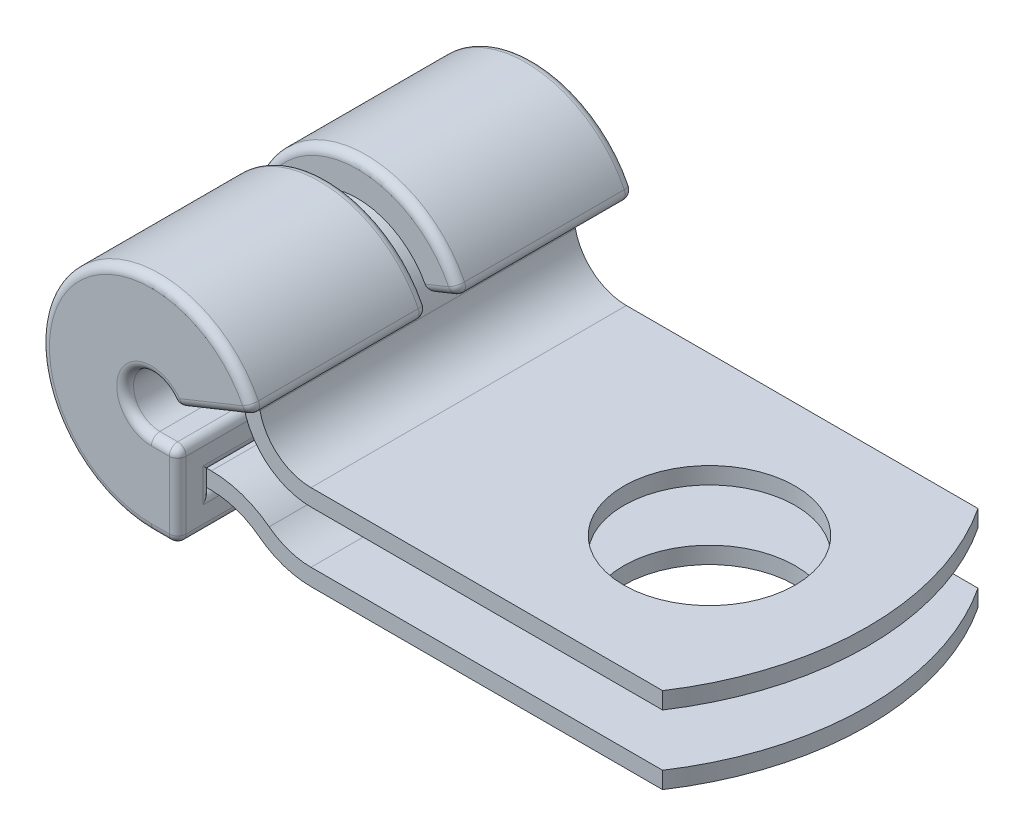
from build123d import *
from build123d.topology import SkipClean

# Parameters (mm, degrees)
BOSS_EXTRUDE1_DEPTH      = 4.7625
BOSS_EXTRUDE1_DEPTH_BACK = 4.7625
SKETCH2_R                = 2.5908
CUT_EXTRUDE1_DEPTH       = 17.882095
CUT_EXTRUDE3_DEPTH       = 17.882095
CUT_EXTRUDE3_DEPTH_BACK  = 17.882095
BOSS_EXTRUDE2_DEPTH      = 5.7785
BOSS_EXTRUDE2_DEPTH_BACK = 5.7785
CUT_EXTRUDE5_DEPTH       = 4.7625
CUT_EXTRUDE4_DEPTH       = 0.4445
CUT_EXTRUDE4_DEPTH_BACK  = 0.4445
FILLET1_R                = 0.254


with BuildPart() as part:
    # Sketch11 → Boss-Extrude1 (new, two sides: drawn at the far end of the back side and taken through both)
    with BuildSketch(Plane.XY.offset(-BOSS_EXTRUDE1_DEPTH_BACK)):
        with BuildLine():
            Line((0, -1.80975), (0.79375, -1.80975))
            ThreePointArc((0.79375, -1.80975), (1.71531, -1.961141), (2.540003, -2.399403))
            ThreePointArc((2.540003, -2.399403), (3.136295, -2.716287), (3.802627, -2.82575))
            Line((3.802627, -2.82575), (15.8496, -2.82575))
            Line((15.8496, -2.82575), (15.8496, -3.33375))
            Line((15.8496, -3.33375), (3.802627, -3.33375))
            ThreePointArc((3.802627, -3.33375), (2.973775, -3.197588), (2.232046, -2.803416))
            ThreePointArc((2.232046, -2.803416), (1.55279, -2.442443), (0.79375, -2.31775))
            Line((0.79375, -2.31775), (0, -2.31775))
            ThreePointArc((0, -2.31775), (-1.805543, 1.453265), (2.264207, 0.49531))
            ThreePointArc((2.264207, 0.49531), (2.815203, -0.39493), (3.802627, -0.74295))
            Line((3.802627, -0.74295), (15.8496, -0.74295))
            Line((15.8496, -0.74295), (15.8496, -1.25095))
            Line((15.8496, -1.25095), (3.802627, -1.25095))
            ThreePointArc((3.802627, -1.25095), (2.496679, -0.790665), (1.767942, 0.386749))
            ThreePointArc((1.767942, 0.386749), (-1.409808, 1.134741), (0, -1.80975))
        make_face()
    extrude(amount=BOSS_EXTRUDE1_DEPTH + BOSS_EXTRUDE1_DEPTH_BACK)

    # Sketch2 → Cut-Extrude1 (cut, through all)
    with BuildSketch(Plane(origin=(0, 0, 0), x_dir=(1, 0, 0), z_dir=(0, 1, 0))):
        with Locations(Location((11.0744, 0, 0), (0, 0, 270))):
            Circle(SKETCH2_R)
    extrude(amount=-CUT_EXTRUDE1_DEPTH, mode=Mode.SUBTRACT)

    # Sketch4 → Cut-Extrude3 (cut, two sides: drawn at the far end of the back side and taken through both)
    with BuildSketch(Plane(origin=(0, 0, 0), x_dir=(1, 0, 0), z_dir=(0, 1, 0)).offset(-CUT_EXTRUDE3_DEPTH_BACK)):
        with BuildLine():
            Line((-12.286228, 45.268235), (14.42085, 4.7625))
            ThreePointArc((14.42085, 4.7625), (15.8496, 0), (14.42085, -4.7625))
            Line((14.42085, -4.7625), (-12.286228, -45.268235))
            Line((-12.286228, -45.268235), (84.749489, -45.268235))
            Line((84.749489, -45.268235), (84.749489, 45.268235))
            Line((84.749489, 45.268235), (-12.286228, 45.268235))
        make_face()
    extrude(amount=CUT_EXTRUDE3_DEPTH + CUT_EXTRUDE3_DEPTH_BACK, mode=Mode.SUBTRACT)


with BuildPart() as body_2:
    # Sketch5 → Boss-Extrude2 (new, two sides: drawn at the far end of the back side and taken through both)
    with BuildSketch(Plane.XY.offset(-BOSS_EXTRUDE2_DEPTH_BACK)):
        with BuildLine():
            Line((0.736405, 0.29622), (3.092901, 1.244126))
            ThreePointArc((3.092901, 1.244126), (-2.762381, 1.866318), (0, -3.33375))
            Line((0, -3.33375), (0.79375, -3.33375))
            Line((0.79375, -3.33375), (0.79375, -0.79375))
            Line((0.79375, -0.79375), (0, -0.79375))
            ThreePointArc((0, -0.79375), (-0.65771, 0.444361), (0.736405, 0.29622))
        make_face()
    extrude(amount=BOSS_EXTRUDE2_DEPTH + BOSS_EXTRUDE2_DEPTH_BACK)

    # Sketch9 → Cut-Extrude5 (cut, symmetric)
    with BuildSketch(Plane.XY):
        with BuildLine():
            Line((0.79375, -1.80975), (0.79375, -2.31775))
            Line((0.79375, -2.31775), (0, -2.31775))
            ThreePointArc((0, -2.31775), (-1.805543, 1.453265), (2.264207, 0.49531))
            Line((2.264207, 0.49531), (1.767942, 0.386749))
            ThreePointArc((1.767942, 0.386749), (-1.409808, 1.134741), (0, -1.80975))
            Line((0, -1.80975), (0.79375, -1.80975))
        make_face()
    extrude(amount=CUT_EXTRUDE5_DEPTH, both=True, mode=Mode.SUBTRACT)

    # Sketch7 → Cut-Extrude4 (cut, two sides: drawn at the far end of the back side and taken through both)
    with SkipClean():  # the faces are left unmerged after this step: merging them gives an invalid solid
        with BuildSketch(Plane.XY.offset(-CUT_EXTRUDE4_DEPTH_BACK)):
            with BuildLine():
                Line((0.79375, -1.80975), (0, -1.80975))
                ThreePointArc((0, -1.80975), (-1.499578, 1.013144), (1.679004, 0.675383))
                Line((1.679004, 0.675383), (3.092901, 1.244126))
                ThreePointArc((3.092901, 1.244126), (-2.762381, 1.866318), (0, -3.33375))
                Line((0, -3.33375), (0.79375, -3.33375))
                Line((0.79375, -3.33375), (0.79375, -1.80975))
            make_face()
        extrude(amount=CUT_EXTRUDE4_DEPTH + CUT_EXTRUDE4_DEPTH_BACK, mode=Mode.SUBTRACT)

    # Fillet1
    fillet1_edges = [body_2.edges().sort_by_distance(p)[0] for p in [
        (0.736405, 0.29622, 0),
        (3.092901, 1.244126, 3.1115),
        (-0.65771, 0.444361, -5.7785),
        (0.396875, -0.79375, -5.7785),
        (0.79375, -2.06375, -5.7785),
        (0.396875, -3.33375, -5.7785),
        (-2.762381, 1.866318, -5.7785),
        (1.914653, 0.770173, -5.7785),
        (0.79375, -3.33375, 3.1115),
        (0.79375, -0.79375, 0),
        (0.396875, -0.79375, 5.7785),
        (2.150303, 0.864964, 2.6035),
        (1.679004, 0.675383, 0),
        (-0.65771, 0.444361, 5.7785),
        (1.914653, 0.770173, 5.7785),
        (1.914653, 0.770173, 4.7625),
        (-2.762381, 1.866318, 5.7785),
        (0.79375, -2.06375, 4.7625),
        (0.396875, -3.33375, 5.7785),
        (0.79375, -2.06375, 5.7785),
        (0.79375, -2.06375, -4.7625),
        (0.79375, -1.80975, 0),
        (0.79375, -2.31775, -2.6035),
        (1.914653, 0.770173, -4.7625),
        (0.79375, -2.31775, 2.6035),
        (2.150303, 0.864964, -2.6035),
        (0.79375, -3.33375, -3.1115),
        (3.092901, 1.244126, -3.1115),
        (2.621602, 1.054545, 0.4445),
        (-2.762381, 1.866318, 0.4445),
        (0.396875, -3.33375, 0.4445),
        (0.79375, -2.82575, 0.4445),
        (0.79375, -2.82575, -0.4445),
        (0.396875, -3.33375, -0.4445),
        (-2.762381, 1.866318, -0.4445),
        (2.621602, 1.054545, -0.4445),
    ]]
    fillet(fillet1_edges, radius=FILLET1_R)


solid = Compound([part.part, body_2.part])
